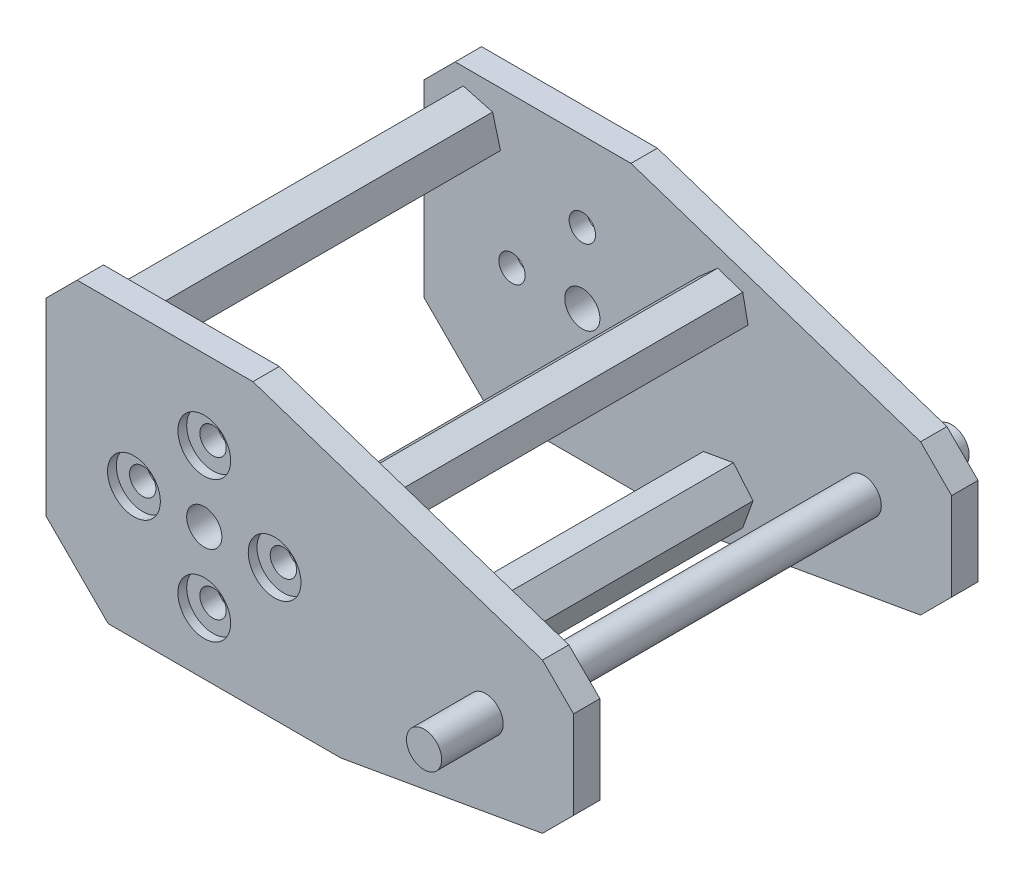
from build123d import *

# Parameters (mm, degrees)
BOSS_EXTRUDE1_DEPTH      = 3
SKETCH4_R                = 2
CUT_EXTRUDE1_DEPTH       = 3
SKETCH5_R                = 3
CUT_EXTRUDE2_DEPTH       = 1
SKETCH6_R                = 1.5
CUT_EXTRUDE3_DEPTH       = 2
BOSS_EXTRUDE2_DEPTH      = 40
BOSS_EXTRUDE3_DEPTH      = 30
BOSS_EXTRUDE3_DEPTH_BACK = 30
SKETCH7_R                = 2
CUT_EXTRUDE5_REACH       = 83.646


with BuildPart() as part:
    # Sketch2 → Boss-Extrude1 (new body)
    with BuildSketch(Plane.XY):
        Polygon((33.535533906, -16.035533906), (3.535533906, -16.035533906), (0, -12.5), (0, 12.5), (3.535533906, 16.035533906), (23.535533906, 16.035533906), (56.464466094, 5.07852329), (60, 1.542989384), (60, -8.457010616), (56.464466094, -11.992544522), align=None)
    boss_extrude1 = extrude(amount=BOSS_EXTRUDE1_DEPTH)

    # Sketch4 → Cut-Extrude1 (cut)
    with BuildSketch(Plane(origin=(0, 0, 0), x_dir=(-1, 0, 0), z_dir=(0, 0, -1))):
        with Locations((-18, -1.035533906)):
            Circle(SKETCH4_R)
    cut_extrude1 = extrude(amount=-CUT_EXTRUDE1_DEPTH, mode=Mode.SUBTRACT)

    # Sketch5 → Cut-Extrude2 (cut)
    with BuildSketch(Plane(origin=(0, 0, 0), x_dir=(-1, 0, 0), z_dir=(0, 0, -1))):
        with Locations((-18, 6.964466094)):
            Circle(SKETCH5_R)
        with Locations((-10, -1.035533906)):
            Circle(SKETCH5_R)
        with Locations((-18, -9.035533906)):
            Circle(SKETCH5_R)
        with Locations((-26, -1.035533906)):
            Circle(SKETCH5_R)
    cut_extrude2 = extrude(amount=-CUT_EXTRUDE2_DEPTH, mode=Mode.SUBTRACT)

    # Sketch6 → Cut-Extrude3 (cut)
    with BuildSketch(Plane(origin=(0, 0, 1), x_dir=(-1, 0, 0), z_dir=(0, 0, -1))):
        with Locations((-18, 6.964466094)):
            Circle(SKETCH6_R)
        with Locations((-26, -1.035533906)):
            Circle(SKETCH6_R)
        with Locations((-10, -1.035533906)):
            Circle(SKETCH6_R)
        with Locations((-18, -9.035533906)):
            Circle(SKETCH6_R)
    cut_extrude3 = extrude(amount=-CUT_EXTRUDE3_DEPTH, mode=Mode.SUBTRACT)

    # Sketch3 → Boss-Extrude2 (add)
    with BuildSketch(Plane.XY.offset(3)):
        Polygon((8.69213043, 9.878421931), (7.795554958, 13.224487146), (4.449489743, 14.121062618), (2, 11.671572875), (2.896575472, 8.32550766), (6.242640687, 7.428932188), align=None)
        Polygon((36.226681597, -13.530158735), (37.411474128, -10.27496801), (35.184792531, -7.621312217), (31.773318403, -8.22284715), (30.588525872, -11.478037875), (32.815207469, -14.131693668), align=None)
        Polygon((36.846550019, 6.760383974), (36.24355834, 9.699159405), (33.397008321, 10.646341008), (31.153449981, 8.65474718), (31.75644166, 5.715971749), (34.602991679, 4.768790146), align=None)
    extrude(amount=BOSS_EXTRUDE2_DEPTH)

    # Mirror1: Boss-Extrude1, Cut-Extrude1, Cut-Extrude2, Cut-Extrude3 across plane
    add(boss_extrude1.mirror(Plane.XY.offset(23)))
    add(cut_extrude1.mirror(Plane.XY.offset(23)), mode=Mode.SUBTRACT)
    add(cut_extrude2.mirror(Plane.XY.offset(23)), mode=Mode.SUBTRACT)
    add(cut_extrude3.mirror(Plane.XY.offset(23)), mode=Mode.SUBTRACT)

    # Sketch7 → Boss-Extrude3 (add, two sides: drawn at the far end of the back side and taken through both)
    with BuildSketch(Plane.XY.offset(23).offset(-BOSS_EXTRUDE3_DEPTH_BACK)):
        with Locations((50, -3.457010616)):
            Circle(SKETCH7_R)
    extrude(amount=BOSS_EXTRUDE3_DEPTH + BOSS_EXTRUDE3_DEPTH_BACK)

    # Cut-Extrude5: up to this face of the body (flat: up to its plane)
    cut_extrude5_end = Plane(part.part.faces().sort_by_distance((18.535533906, -15.35519918, 46))[0])
    # Sketch9 → Cut-Extrude5 (cut, up to the picked face)
    with BuildSketch(Plane(origin=(0, 0, 0), x_dir=(-1, 0, 0), z_dir=(0, 0, -1)), mode=Mode.PRIVATE) as cut_extrude5_sk1:
        Polygon((0, -8.964466094), (-7.071067812, -16.035533906), (0, -16.035533906), align=None)
    cut_extrude5_tool1 = split(extrude(cut_extrude5_sk1.sketch, amount=-CUT_EXTRUDE5_REACH, mode=Mode.PRIVATE), bisect_by=cut_extrude5_end, keep=Keep.BOTH, mode=Mode.PRIVATE)
    add(cut_extrude5_tool1.solids().sort_by(Axis((2.357023, -13.678511, 0), (0, 0, 1)))[0], mode=Mode.SUBTRACT)


solid = part.part
